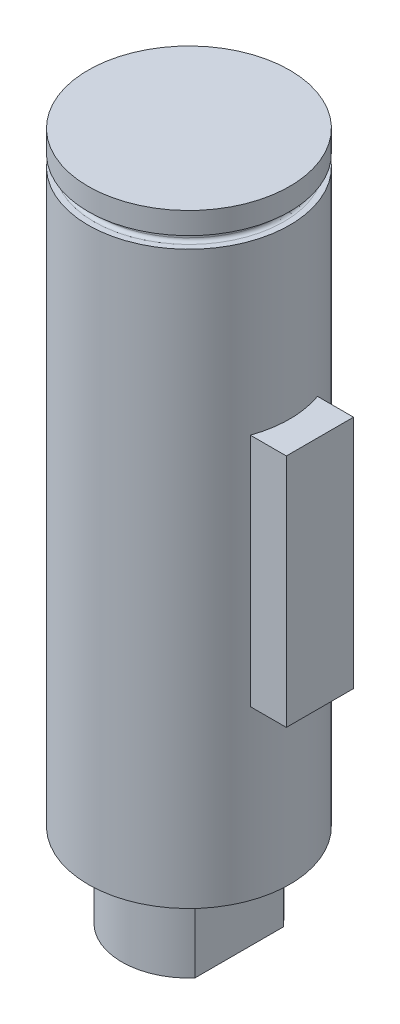
from build123d import *

# Parameters (mm, degrees)
BOSS_EXTRUDE1_DEPTH = 14
SKETCH2_R           = 6
BOSS_EXTRUDE2_DEPTH = 12
BOSS_EXTRUDE3_START = 10
SKETCH3_R           = 6
BOSS_EXTRUDE3_DEPTH = 10
SKETCH4_R           = 1.5
CUT_EXTRUDE1_DEPTH  = 5
BOSS_EXTRUDE4_START = 5
SKETCH5_R           = 1.5
BOSS_EXTRUDE4_DEPTH = 5


with BuildPart() as part:
    # Sketch1 → Boss-Extrude1 (new body)
    with BuildSketch(Plane(origin=(0, 0, 0), x_dir=(1, 0, 0), z_dir=(0, 1, 0))):
        with BuildLine():
            Line((7.8, -2), (7.8, 2))
            Line((7.8, 2), (5.656854249, 2))
            ThreePointArc((5.656854249, 2), (-6, 0), (5.656854249, -2))
            Line((5.656854249, -2), (7.8, -2))
        make_face()
    extrude(amount=BOSS_EXTRUDE1_DEPTH)

    # Sketch2 → Boss-Extrude2 (add)
    with BuildSketch(Plane(origin=(0, 14, 0), x_dir=(1, 0, 0), z_dir=(0, 1, 0))):
        with Locations(Location((0, 0, 0), (0, 0, 19.471220634))):
            Circle(SKETCH2_R)
    extrude(amount=BOSS_EXTRUDE2_DEPTH)

    # Sketch3 → Boss-Extrude3 (add)
    with BuildSketch(Plane.XZ.offset(BOSS_EXTRUDE3_START)):
        with Locations(Location((0, 0, 0), (0, 0, 270))):
            Circle(SKETCH3_R)
    extrude(amount=-BOSS_EXTRUDE3_DEPTH)

    # Sketch4 → Cut-Extrude1 (cut)
    with BuildSketch(Plane.XZ.offset(10)):
        with Locations(Location((0, 0, 0), (0, 0, 270))):
            Circle(SKETCH4_R)
    extrude(amount=-CUT_EXTRUDE1_DEPTH, mode=Mode.SUBTRACT)

    # Groove Sketch → Retaining Ring Groove (revolve, cut)
    with BuildSketch(Plane(origin=(1.604252923, 12.182890291, 0.373259529), x_dir=(-0.9343262431877186, 0.2824476966643587, -0.2173885230174828), z_dir=(-0.2266157025474993, 0, 0.9739842521103221)), mode=Mode.PRIVATE) as retaining_ring_groove_sk:
        with BuildLine():
            Line((10.535414006, -9.946396708), (11.998320123, -9.51566397))
            Line((11.998320123, -9.51566397), (11.800606735, -8.84416608))
            Line((11.800606735, -8.84416608), (10.337700618, -9.274898818))
            ThreePointArc((10.337700618, -9.274898818), (10.21858296, -9.371036434), (10.202333617, -9.523244897))
            Line((10.202333617, -9.523244897), (10.287067926, -9.811029707))
            ThreePointArc((10.287067926, -9.811029707), (10.383205542, -9.930147365), (10.535414006, -9.946396708))
        make_face()
    revolve(retaining_ring_groove_sk.sketch.rotate(Axis((0, 60.224615576, 0), (0, -1, 0)), 76.902094509), axis=Axis((0, 60.224615576, 0), (0, -1, 0)), mode=Mode.SUBTRACT)

    # Sketch5 → Boss-Extrude4 (add)
    with BuildSketch(Plane.XZ.offset(10).offset(BOSS_EXTRUDE4_START)):
        with BuildLine():
            Line((3, -2.645751311), (3, 2.645751311))
            ThreePointArc((3, 2.645751311), (-4, 0), (3, -2.645751311))
        make_face()
        with Locations(Location((0, 0, 0), (0, 0, 270))):
            Circle(SKETCH5_R, mode=Mode.SUBTRACT)
    extrude(amount=-BOSS_EXTRUDE4_DEPTH)


solid = part.part
